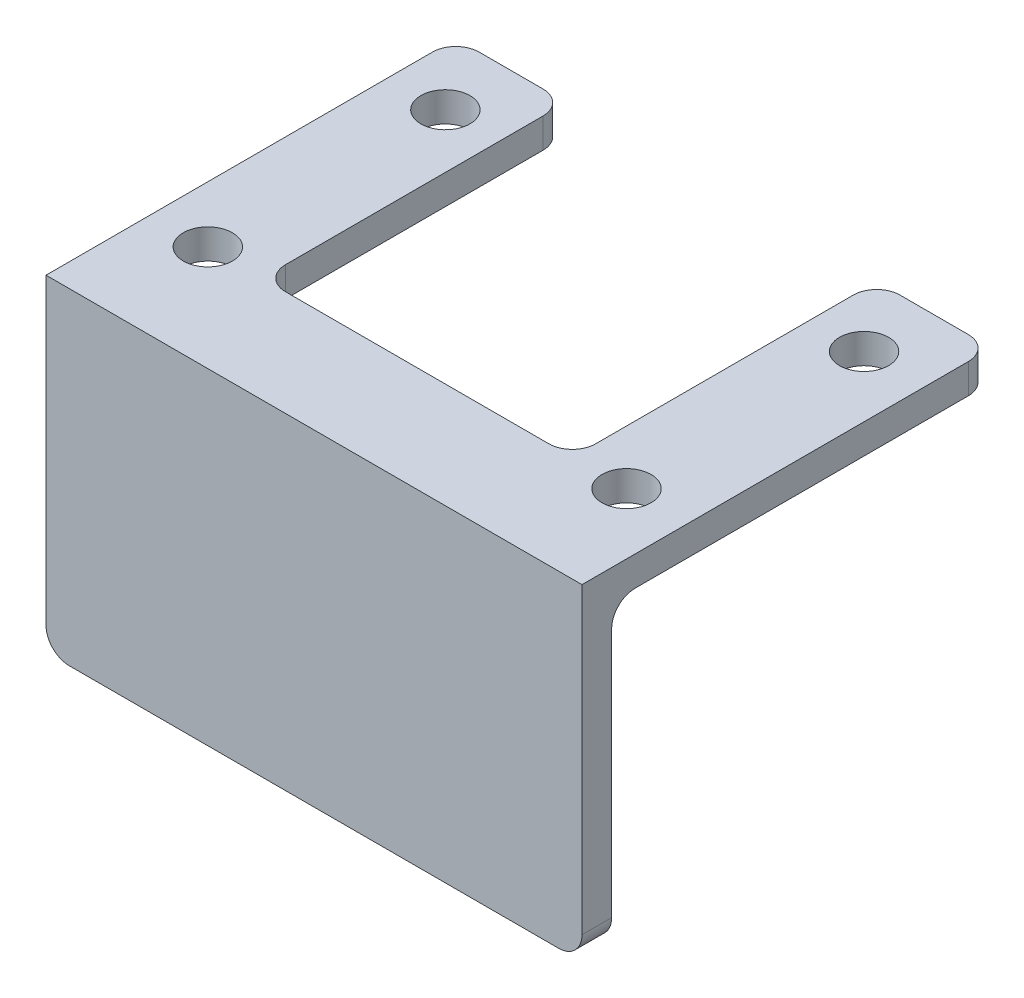
from build123d import *

# Parameters (mm, degrees)
SKETCH1_R                = 2.1
BOSS_EXTRUDE1_DEPTH      = 2.54
BOSS_EXTRUDE2_DEPTH      = 25.4
BOSS_EXTRUDE2_DEPTH_BACK = 2.54
SKETCH2_W                = 45.847007751
SKETCH2_H                = 2.54
FILLET1_R                = 2


with BuildPart() as part:
    # Sketch1 → Boss-Extrude1 (new body)
    with BuildSketch(Plane(origin=(0, 0, 0), x_dir=(1, 0, 0), z_dir=(0, 1, 0))):
        Polygon((15.569104138, 29.110597295), (25.03510725, 29.110597295), (25.03510725, 3.075596379), (51.56910725, 3.075596379), (51.56910725, 29.110597295), (61.416111889, 29.110597295), (61.416111889, -2.131403285), (61.416111889, -3.401403285), (15.569104138, -3.401403285), (15.569104138, -2.131403285), align=None)
        with Locations(Location((20.39510725, 23.395596379, 0), (0, 0, 270))):
            Circle(SKETCH1_R, mode=Mode.SUBTRACT)
        with Locations(Location((20.39510725, 3.075596379, 0), (0, 0, 270))):
            Circle(SKETCH1_R, mode=Mode.SUBTRACT)
        with Locations(Location((56.20910725, 23.395596379, 0), (0, 0, 270))):
            Circle(SKETCH1_R, mode=Mode.SUBTRACT)
        with Locations(Location((56.20910725, 3.075596379, 0), (0, 0, 270))):
            Circle(SKETCH1_R, mode=Mode.SUBTRACT)
    extrude(amount=BOSS_EXTRUDE1_DEPTH)

    # Sketch2 → Boss-Extrude2 (add, two sides: drawn at the far end of the back side and taken through both)
    with BuildSketch(Plane.XZ.offset(-BOSS_EXTRUDE2_DEPTH_BACK)):
        with Locations((38.492608014, 4.671403285)):
            Rectangle(SKETCH2_W, SKETCH2_H)
    extrude(amount=BOSS_EXTRUDE2_DEPTH + BOSS_EXTRUDE2_DEPTH_BACK)

    # Fillet1
    fillet1_edges = [part.edges().sort_by_distance(p)[0] for p in [
        (38.492608013, 0, 3.401403285),
        (15.569104138, 1.27, -29.110597295),
        (25.03510725, 1.27, -29.110597295),
        (25.03510725, 1.27, -3.075596379),
        (51.56910725, 1.27, -3.075596379),
        (51.56910725, 1.27, -29.110597295),
        (61.416111889, 1.27, -29.110597295),
        (15.569104138, -25.4, 4.671403285),
        (61.416111889, -25.4, 4.671403285),
    ]]
    fillet(fillet1_edges, radius=FILLET1_R)


solid = part.part
